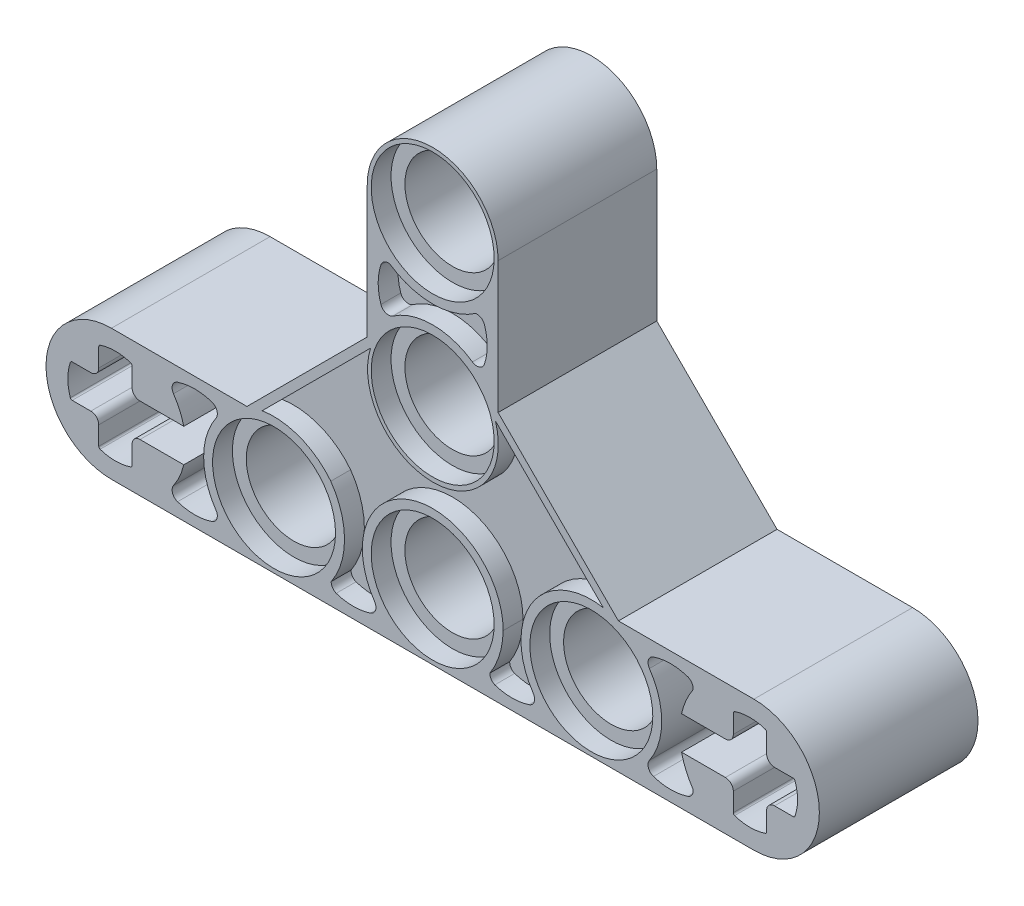
from build123d import *

# Parameters (mm, degrees)
SKETCH2_R           = 2.4
BOSS_EXTRUDE1_DEPTH = 4
SKETCH4_R           = 3.1
CUT_EXTRUDE1_DEPTH  = 1
CUT_EXTRUDE2_DEPTH  = 1


with BuildPart() as part:
    # Sketch2 → Boss-Extrude1 (new, symmetric)
    with BuildSketch(Plane.XY):
        with BuildLine():
            Line((-16.2, -3.3), (16.2, -3.3))
            ThreePointArc((16.2, -3.3), (19.5, 0), (16.2, 3.3))
            Line((16.2, 3.3), (9.366904756, 3.3))
            Line((9.366904756, 3.3), (3.3, 9.366904756))
            Line((3.3, 9.366904756), (3.3, 16))
            ThreePointArc((3.3, 16), (0, 19.3), (-3.3, 16))
            Line((-3.3, 16), (-3.3, 9.366904756))
            Line((-3.3, 9.366904756), (-9.366904756, 3.3))
            Line((-9.366904756, 3.3), (-16.2, 3.3))
            ThreePointArc((-16.2, 3.3), (-19.5, 0), (-16.2, -3.3))
        make_face()
        with BuildLine():
            Line((-18.177705214, 0.84), (-17.24, 0.84))
            ThreePointArc((-17.24, 0.84), (-16.957157288, 0.957157288), (-16.84, 1.24))
            Line((-16.84, 1.24), (-16.84, 2.177705214))
            ThreePointArc((-16.84, 2.177705214), (-16.821293884, 2.235940121), (-16.772173913, 2.27238805))
            ThreePointArc((-16.772173913, 2.27238805), (-16, 2.4), (-15.227826087, 2.27238805))
            ThreePointArc((-15.227826087, 2.27238805), (-15.178706116, 2.235940121), (-15.16, 2.177705214))
            Line((-15.16, 2.177705214), (-15.16, 1.24))
            ThreePointArc((-15.16, 1.24), (-15.042842712, 0.957157288), (-14.76, 0.84))
            Line((-14.76, 0.84), (-13.822294786, 0.84))
            Line((-13.822294786, 0.84), (-13.751800721, 0.84))
            Line((-13.751800721, 0.84), (-12.55081169, 0.84))
            ThreePointArc((-12.55081169, 0.84), (-12.757752494, 1.445797742), (-13.070126582, 2.004580194))
            ThreePointArc((-13.070126582, 2.004580194), (-13.119033599, 2.358251088), (-12.865957447, 2.610099174))
            ThreePointArc((-12.865957447, 2.610099174), (-12, 2.75), (-11.134042553, 2.610099174))
            ThreePointArc((-11.134042553, 2.610099174), (-10.880966401, 2.358251088), (-10.929873418, 2.004580194))
            ThreePointArc((-10.929873418, 2.004580194), (-11.55, 0), (-10.929873418, -2.004580194))
            ThreePointArc((-10.929873418, -2.004580194), (-10.880966401, -2.358251088), (-11.134042553, -2.610099174))
            ThreePointArc((-11.134042553, -2.610099174), (-12, -2.75), (-12.865957447, -2.610099174))
            ThreePointArc((-12.865957447, -2.610099174), (-13.119033599, -2.358251088), (-13.070126582, -2.004580194))
            ThreePointArc((-13.070126582, -2.004580194), (-12.757752494, -1.445797742), (-12.55081169, -0.84))
            Line((-12.55081169, -0.84), (-13.751800721, -0.84))
            Line((-13.751800721, -0.84), (-13.822294786, -0.84))
            Line((-13.822294786, -0.84), (-14.76, -0.84))
            ThreePointArc((-14.76, -0.84), (-15.042842712, -0.957157288), (-15.16, -1.24))
            Line((-15.16, -1.24), (-15.16, -2.177705214))
            ThreePointArc((-15.16, -2.177705214), (-15.178706116, -2.235940121), (-15.227826087, -2.27238805))
            ThreePointArc((-15.227826087, -2.27238805), (-16, -2.4), (-16.772173913, -2.27238805))
            ThreePointArc((-16.772173913, -2.27238805), (-16.821293884, -2.235940121), (-16.84, -2.177705214))
            Line((-16.84, -2.177705214), (-16.84, -1.24))
            ThreePointArc((-16.84, -1.24), (-16.957157288, -0.957157288), (-17.24, -0.84))
            Line((-17.24, -0.84), (-18.177705214, -0.84))
            ThreePointArc((-18.177705214, -0.84), (-18.235940121, -0.821293884), (-18.27238805, -0.772173913))
            ThreePointArc((-18.27238805, -0.772173913), (-18.4, 0), (-18.27238805, 0.772173913))
            ThreePointArc((-18.27238805, 0.772173913), (-18.235940121, 0.821293884), (-18.177705214, 0.84))
        make_face(mode=Mode.SUBTRACT)
        with Locations((-8, 0)):
            Circle(SKETCH2_R, mode=Mode.SUBTRACT)
        Circle(SKETCH2_R, mode=Mode.SUBTRACT)
        with Locations((8, 0)):
            Circle(SKETCH2_R, mode=Mode.SUBTRACT)
        with BuildLine():
            Line((16.84, 2.177705214), (16.84, 1.24))
            ThreePointArc((16.84, 1.24), (16.957157288, 0.957157288), (17.24, 0.84))
            Line((17.24, 0.84), (18.177705214, 0.84))
            ThreePointArc((18.177705214, 0.84), (18.235940121, 0.821293884), (18.27238805, 0.772173913))
            ThreePointArc((18.27238805, 0.772173913), (18.4, 0), (18.27238805, -0.772173913))
            ThreePointArc((18.27238805, -0.772173913), (18.235940121, -0.821293884), (18.177705214, -0.84))
            Line((18.177705214, -0.84), (17.24, -0.84))
            ThreePointArc((17.24, -0.84), (16.957157288, -0.957157288), (16.84, -1.24))
            Line((16.84, -1.24), (16.84, -2.177705214))
            ThreePointArc((16.84, -2.177705214), (16.821293884, -2.235940121), (16.772173913, -2.27238805))
            ThreePointArc((16.772173913, -2.27238805), (16, -2.4), (15.227826087, -2.27238805))
            ThreePointArc((15.227826087, -2.27238805), (15.178706116, -2.235940121), (15.16, -2.177705214))
            Line((15.16, -2.177705214), (15.16, -1.24))
            ThreePointArc((15.16, -1.24), (15.042842712, -0.957157288), (14.76, -0.84))
            Line((14.76, -0.84), (13.822294786, -0.84))
            Line((13.822294786, -0.84), (13.751800721, -0.84))
            Line((13.751800721, -0.84), (12.55081169, -0.84))
            ThreePointArc((12.55081169, -0.84), (12.776635558, -1.532291094), (13.129021511, -2.169541059))
            ThreePointArc((13.129021511, -2.169541059), (13.077439209, -2.437559337), (12.865957447, -2.610099174))
            ThreePointArc((12.865957447, -2.610099174), (12, -2.75), (11.134042553, -2.610099174))
            ThreePointArc((11.134042553, -2.610099174), (10.880966401, -2.358251088), (10.929873418, -2.004580194))
            ThreePointArc((10.929873418, -2.004580194), (11.55, 0), (10.929873418, 2.004580194))
            ThreePointArc((10.929873418, 2.004580194), (10.880966401, 2.358251088), (11.134042553, 2.610099174))
            ThreePointArc((11.134042553, 2.610099174), (12, 2.75), (12.865957447, 2.610099174))
            ThreePointArc((12.865957447, 2.610099174), (13.077439209, 2.437559337), (13.129021511, 2.169541059))
            ThreePointArc((13.129021511, 2.169541059), (12.776635558, 1.532291094), (12.55081169, 0.84))
            Line((12.55081169, 0.84), (13.751800721, 0.84))
            Line((13.751800721, 0.84), (13.822294786, 0.84))
            Line((13.822294786, 0.84), (14.76, 0.84))
            ThreePointArc((14.76, 0.84), (15.042842712, 0.957157288), (15.16, 1.24))
            Line((15.16, 1.24), (15.16, 2.177705214))
            ThreePointArc((15.16, 2.177705214), (15.178706116, 2.235940121), (15.227826087, 2.27238805))
            ThreePointArc((15.227826087, 2.27238805), (16, 2.4), (16.772173913, 2.27238805))
            ThreePointArc((16.772173913, 2.27238805), (16.821293884, 2.235940121), (16.84, 2.177705214))
        make_face(mode=Mode.SUBTRACT)
        with Locations((0, 8)):
            Circle(SKETCH2_R, mode=Mode.SUBTRACT)
        with Locations((0, 16)):
            Circle(SKETCH2_R, mode=Mode.SUBTRACT)
    extrude(amount=BOSS_EXTRUDE1_DEPTH, both=True)

    # Sketch4 → Cut-Extrude1 (cut)
    with BuildSketch(Plane.XY.offset(4)):
        Circle(SKETCH4_R)
        with Locations((8, 0)):
            Circle(SKETCH4_R)
        with Locations((-8, 0)):
            Circle(SKETCH4_R)
        with Locations((0, 8)):
            Circle(SKETCH4_R)
        with Locations((0, 16)):
            Circle(SKETCH4_R)
    cut_extrude1 = extrude(amount=-CUT_EXTRUDE1_DEPTH, mode=Mode.SUBTRACT)

    # Mirror1: Cut-Extrude1 across plane
    add(cut_extrude1.mirror(Plane.XY), mode=Mode.SUBTRACT)

    # Sketch5 → Cut-Extrude2 (cut)
    with BuildSketch(Plane(origin=(0, 0, -4), x_dir=(-1, 0, 0), z_dir=(0, 0, -1))):
        with BuildLine():
            Line((-8.60453447, 3.495846804), (-3.165930566, 8.934450707))
            ThreePointArc((-3.165930566, 8.934450707), (0.003594416, 4.67910033), (3.132274525, 8.964570692))
            Line((3.132274525, 8.964570692), (8.600998413, 3.495846805))
            ThreePointArc((8.600998413, 3.495846805), (6.687659559, 3.291708126), (5.13869376, 2.150111385))
            ThreePointArc((5.13869376, 2.150111385), (4.445544513, -0.03189944), (5.116625895, -2.220797997))
            ThreePointArc((5.116625895, -2.220797997), (5.053346481, -2.455405267), (4.865957447, -2.610099174))
            ThreePointArc((4.865957447, -2.610099174), (4, -2.75), (3.134042553, -2.610099174))
            ThreePointArc((3.134042553, -2.610099174), (2.881472437, -2.359742175), (2.92810539, -2.00718628))
            ThreePointArc((2.92810539, -2.00718628), (3.386475023, -1.04926651), (3.549988588, 7.677e-06))
            ThreePointArc((3.549988588, 7.677e-06), (-0.017368929, 3.527999325), (-3.554486224, -0.030310098))
            ThreePointArc((-3.554486224, -0.030310098), (-3.373822587, -1.173009312), (-2.883374105, -2.220797997))
            ThreePointArc((-2.883374105, -2.220797997), (-2.946653519, -2.455405267), (-3.134042553, -2.610099174))
            ThreePointArc((-3.134042553, -2.610099174), (-4, -2.75), (-4.865957447, -2.610099174))
            ThreePointArc((-4.865957447, -2.610099174), (-5.118527563, -2.359742175), (-5.07189461, -2.00718628))
            ThreePointArc((-5.07189461, -2.00718628), (-4.451768028, -0.002606085), (-5.07189461, 2.001974109))
            ThreePointArc((-5.07189461, 2.001974109), (-6.61910009, 3.267061998), (-8.60453447, 3.495846804))
        make_face()
        with BuildLine():
            ThreePointArc((2.610099174, 11.134042553), (2.75, 12), (2.610099174, 12.865957447))
            ThreePointArc((2.610099174, 12.865957447), (2.437559337, 13.077439209), (2.169541059, 13.129021511))
            ThreePointArc((2.169541059, 13.129021511), (0, 12.457863487), (-2.169541059, 13.129021511))
            ThreePointArc((-2.169541059, 13.129021511), (-2.437559337, 13.077439209), (-2.610099174, 12.865957447))
            ThreePointArc((-2.610099174, 12.865957447), (-2.75, 12), (-2.610099174, 11.134042553))
            ThreePointArc((-2.610099174, 11.134042553), (-2.358251088, 10.880966401), (-2.004580194, 10.929873418))
            ThreePointArc((-2.004580194, 10.929873418), (0, 11.55), (2.004580194, 10.929873418))
            ThreePointArc((2.004580194, 10.929873418), (2.358251088, 10.880966401), (2.610099174, 11.134042553))
        make_face()
    cut_extrude2 = extrude(amount=-CUT_EXTRUDE2_DEPTH, mode=Mode.SUBTRACT)

    # Mirror2: Cut-Extrude2 across plane
    add(cut_extrude2.mirror(Plane.XY), mode=Mode.SUBTRACT)


solid = part.part
